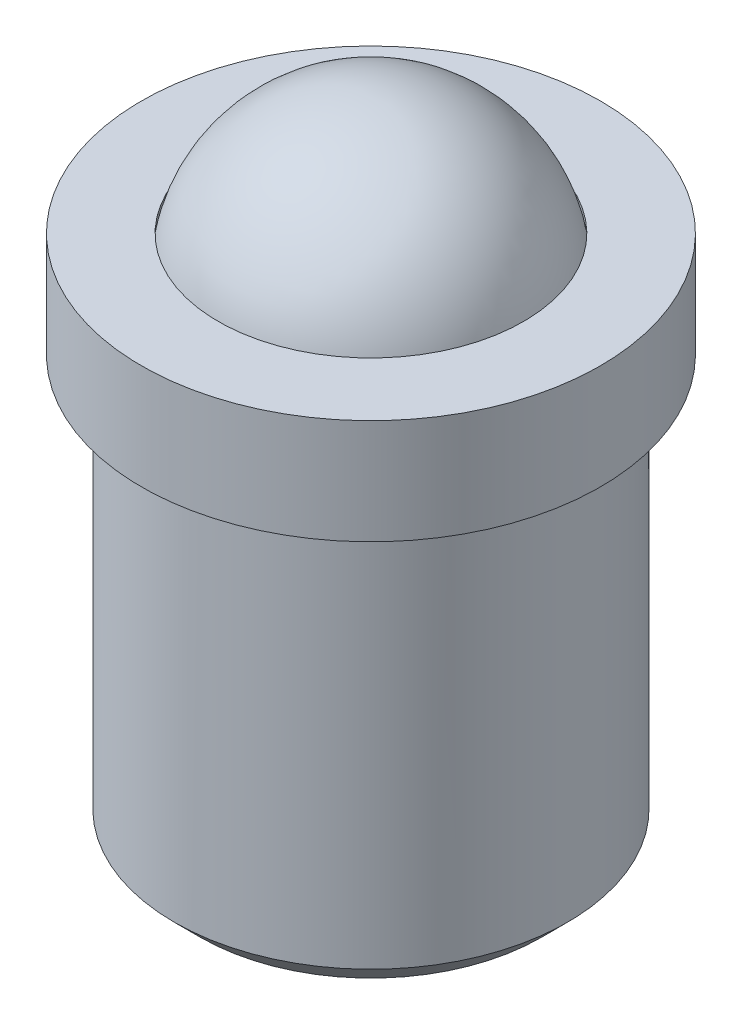
from build123d import *

# Parameters (mm, degrees)
CHAMFER_1_SIZE = 0.2


with BuildPart() as part:
    # 草图1 → 旋转1 (revolve)
    with BuildSketch(Plane(origin=(0, 0, 0), x_dir=(0, 0, -1), z_dir=(1, 0, 0))):
        with BuildLine():
            Line((0.3, 0), (1.5, 0))
            Line((1.5, 0), (1.5, 3.2))
            Line((1.5, 3.2), (1.75, 3.2))
            Line((1.75, 3.2), (1.75, 4))
            Line((1.75, 4), (1.164431192, 4))
            ThreePointArc((1.164431192, 4), (1.191074605, 3.856086567), (1.2, 3.71))
            Line((1.2, 3.71), (1.2, 0.3))
            Line((1.2, 0.3), (0.3, 0.3))
            Line((0.3, 0.3), (0.3, 0))
        make_face()
    revolve(axis=Axis((0, 0, 0), (0, 1, 0)))

    # 倒角1
    chamfer_1_edges = [part.edges().sort_by_distance(p)[0] for p in [
        (0, 0, 1.5),
    ]]
    chamfer(chamfer_1_edges, length=CHAMFER_1_SIZE)


with BuildPart() as body_2:
    # 草图2 → 旋转2 (revolve)
    with BuildSketch(Plane(origin=(0, 0, 0), x_dir=(0, 0, -1), z_dir=(1, 0, 0))):
        with BuildLine():
            Line((0, 4.9), (0, 2.52))
            ThreePointArc((0, 2.52), (1.19, 3.71), (0, 4.9))
        make_face()
    revolve(axis=Axis((0, 5.532857048, 0), (0, -1, 0)))


solid = Compound([part.part, body_2.part])
